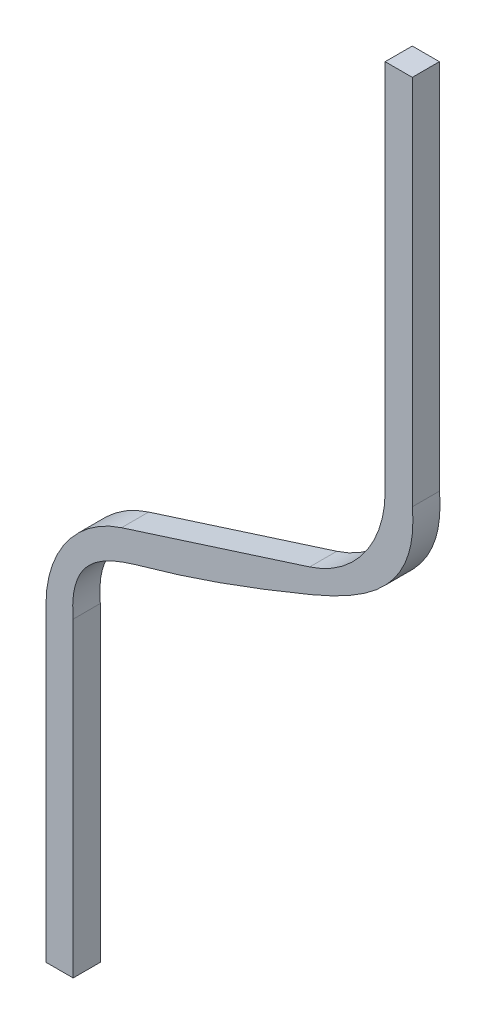
from build123d import *

# Parameters (mm, degrees)
RESSALTO_EXTRUS_O1_DEPTH = 0.2


with BuildPart() as part:
    # Esboço1 → Ressalto-extrusão1 (new body)
    with BuildSketch(Plane.XY):
        with BuildLine():
            Line((0, 0), (0, 2.291006443))
            ThreePointArc((0, 2.291006443), (0.153971983, 2.762862143), (0.556619504, 3.053086448))
            Line((0.556619504, 3.053086448), (1.943380496, 3.495967217))
            ThreePointArc((1.943380496, 3.495967217), (2.346028017, 3.786191523), (2.5, 4.258047222))
            Line((2.5, 4.258047222), (2.5, 7))
            Line((2.5, 7), (2.7, 7))
            Line((2.7, 7), (2.7, 4.258047222))
            add(Edge.make_bspline(
                [(0.2, 2.291006443), (0.158704205, 2.746400788), (0.661928351, 2.858924747), (1.298763247, 3.0650825), (2.066064892, 3.359983666), (2.753500887, 3.666979694), (2.7, 4.258047222)],
                knots=[0, 0, 0, 0, 0.272332766, 0.409919088, 0.591592104, 1, 1, 1, 1], degree=3))
            Line((0.2, 2.291006443), (0.2, 0))
            Line((0.2, 0), (0, 0))
        make_face()
    extrude(amount=RESSALTO_EXTRUS_O1_DEPTH)


solid = part.part
